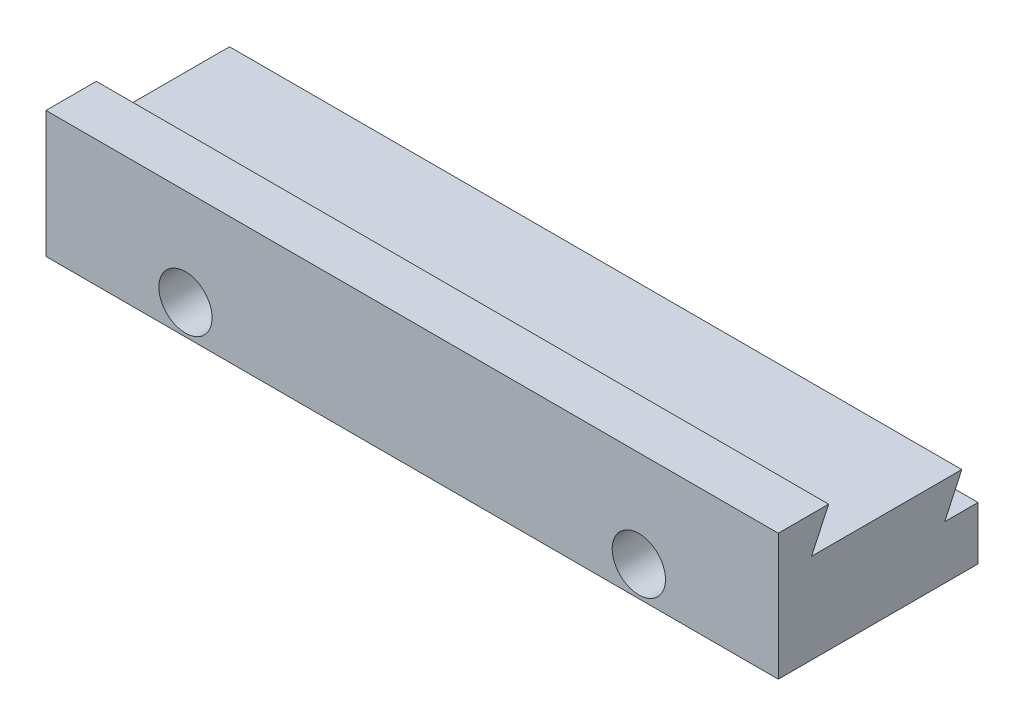
from build123d import *

# Parameters (mm, degrees)
BOSS_EXTRUDE1_DEPTH = 110
SKETCH2_R           = 2.1
CUT_EXTRUDE1_DEPTH  = 30
SKETCH3_R           = 4
CUT_EXTRUDE2_DEPTH  = 20


with BuildPart() as part:
    # Sketch1 → Boss-Extrude1 (new body)
    with BuildSketch(Plane(origin=(0, 0, 0), x_dir=(0, 0, -1), z_dir=(1, 0, 0))):
        Polygon((0, 0), (0, 19), (7.56469212, 19), (5, 13.5), (27.56469212, 13.5), (25, 8), (30, 8), (30, 0), align=None)
    extrude(amount=BOSS_EXTRUDE1_DEPTH)

    # Sketch2 → Cut-Extrude1 (cut)
    with BuildSketch(Plane(origin=(0, 0, -30), x_dir=(-1, 0, 0), z_dir=(0, 0, -1))):
        with Locations((-20.948830341, 4.5)):
            Circle(SKETCH2_R)
        with Locations((-89.051169659, 4.5)):
            Circle(SKETCH2_R)
    extrude(amount=-CUT_EXTRUDE1_DEPTH, mode=Mode.SUBTRACT)

    # Sketch3 → Cut-Extrude2 (cut)
    with BuildSketch(Plane.XY):
        with Locations((20.948830341, 4.5)):
            Circle(SKETCH3_R)
        with Locations((89.051169659, 4.5)):
            Circle(SKETCH3_R)
    extrude(amount=-CUT_EXTRUDE2_DEPTH, mode=Mode.SUBTRACT)


solid = part.part
